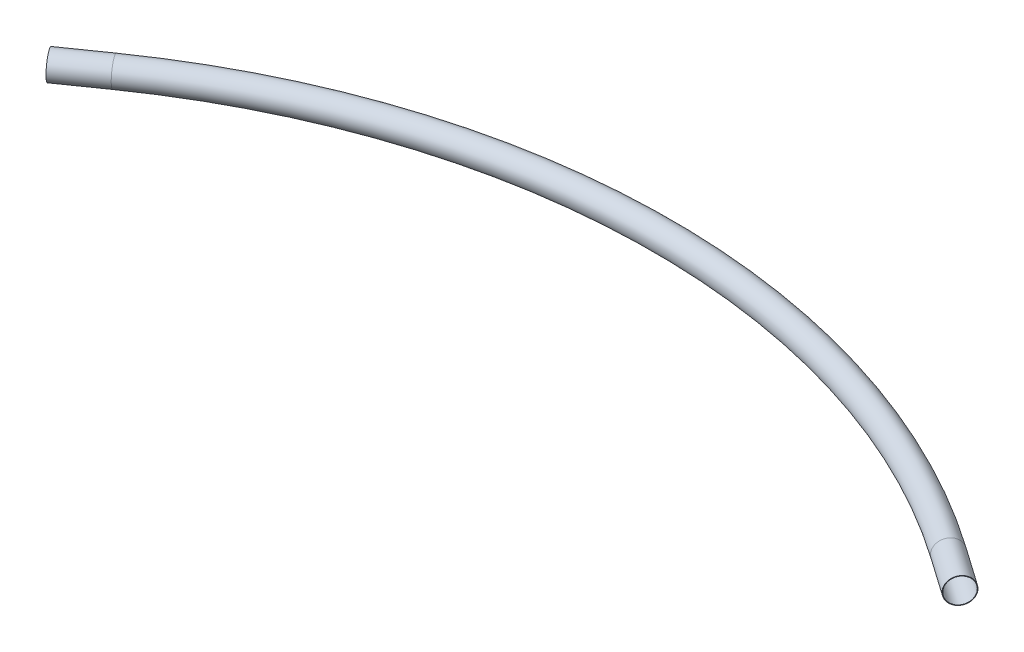
from build123d import *

# Parameters (mm, degrees)
SKETCH12_R                 = 84.1375
SKETCH12_R_2               = 80.7339
STRUCTURAL_MEMBER1_DEPTH   = 304.8
SKETCH12_ON_SEGMENT_2_R    = 84.1375
SKETCH12_ON_SEGMENT_2_R_2  = 80.7339
STRUCTURAL_MEMBER1_2_ANGLE = 69.980381242
SKETCH12_ON_SEGMENT_3_R    = 84.1375
SKETCH12_ON_SEGMENT_3_R_2  = 80.7339
STRUCTURAL_MEMBER1_3_DEPTH = 304.8


with BuildPart() as part:
    # Sketch12 → Structural Member1 (new body)
    with BuildSketch(Plane(origin=(2714.625, 0, 0), x_dir=(-0.5734361842344712, 0, 0.8192502319869124), z_dir=(-0.8192502319869123, 0, -0.5734361842344711))):
        Circle(SKETCH12_R)
        Circle(SKETCH12_R_2, mode=Mode.SUBTRACT)
    extrude(amount=-STRUCTURAL_MEMBER1_DEPTH)


with BuildPart() as body_2:
    # Sketch12 on segment 2 (carried to the start of arc 2) → Structural Member1 2 (revolve)
    with BuildSketch(Plane(origin=(2714.625, 0, 0), x_dir=(0.573436184, 0, -0.819250232), z_dir=(0.819250232, 0, 0.573436184))):
        Circle(SKETCH12_ON_SEGMENT_2_R)
        Circle(SKETCH12_ON_SEGMENT_2_R_2, mode=Mode.SUBTRACT)
    revolve(axis=Axis((0, 0, 3878.299315863), (0, 1, 0)), revolution_arc=STRUCTURAL_MEMBER1_2_ANGLE)


with BuildPart() as body_3:
    # Sketch12 on segment 3 (carried to segment 3) → Structural Member1 3 (new body)
    with BuildSketch(Plane(origin=(-2964.33247071, 0, 174.783348955), x_dir=(-0.573436184, 0, -0.819250232), z_dir=(0.819250232, 0, -0.573436184))):
        Circle(SKETCH12_ON_SEGMENT_3_R)
        Circle(SKETCH12_ON_SEGMENT_3_R_2, mode=Mode.SUBTRACT)
    extrude(amount=STRUCTURAL_MEMBER1_3_DEPTH)


solid = Compound([part.part, body_2.part, body_3.part])
